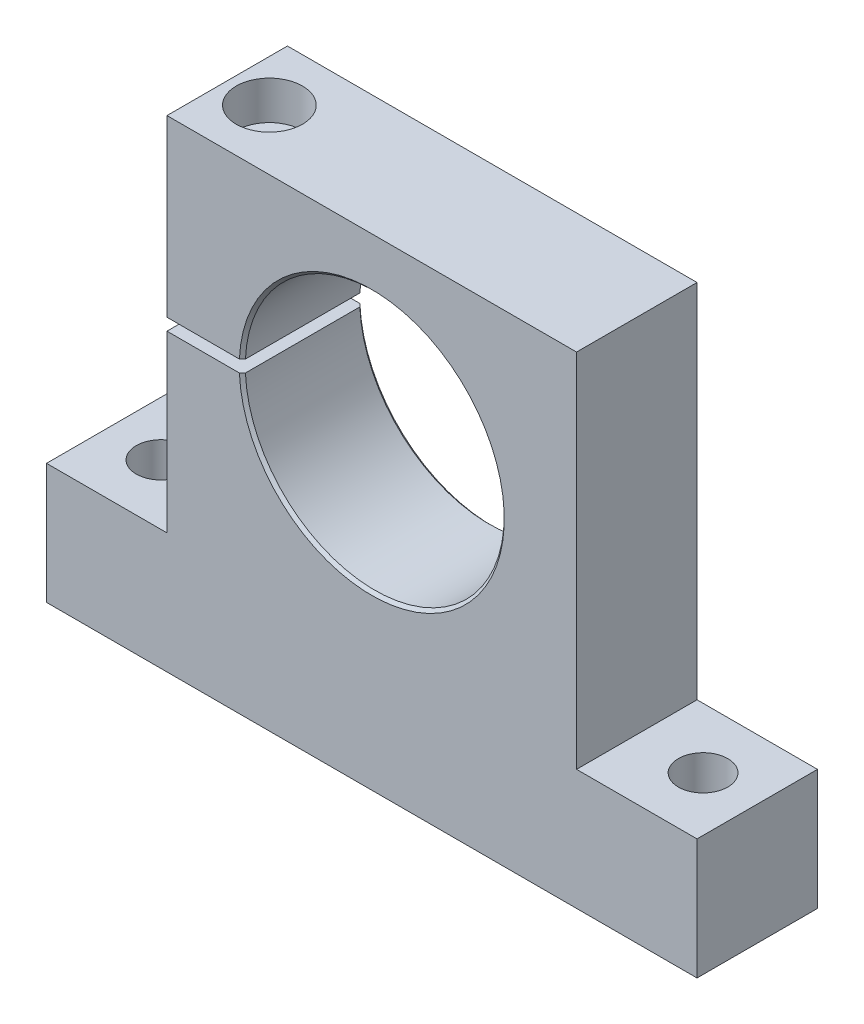
from build123d import *

# Parameters (mm, degrees)
SCHIZZO1_R                                          = 21.5
ESTRUSIONE_ESTRUSIONE1_DEPTH                        = 20
F_8_2_8_2_DIAMETER_HOLE1_D                          = 8.2
CBORE_FOR_M6_HEX_SOCKET_HEAD_CAP_SCREW1_D           = 6.6
CBORE_FOR_M6_HEX_SOCKET_HEAD_CAP_SCREW1_DEPTH       = 50
CBORE_FOR_M6_HEX_SOCKET_HEAD_CAP_SCREW1_CBORE_D     = 11
CBORE_FOR_M6_HEX_SOCKET_HEAD_CAP_SCREW1_CBORE_DEPTH = 6.4
CBORE_FOR_M6_HEX_SOCKET_HEAD_CAP_SCREW1_TIP         = 1.982840043
SCHIZZO7_W                                          = 15.52137419
SCHIZZO7_H                                          = 2
TAGLIO_ESTRUSIONE1_DEPTH                            = 136.882302012
CHAMFER1_SIZE                                       = 0.5
CHAMFER2_SIZE                                       = 0.5


with BuildPart() as part:
    # Schizzo1 → Estrusione-Estrusione1 (new body)
    with BuildSketch(Plane.XY):
        Polygon((0, 0), (108, 0), (108, 20), (88, 20), (88, 80), (20, 80), (20, 20), (0, 20), align=None)
        with Locations((54, 50)):
            Circle(SCHIZZO1_R, mode=Mode.SUBTRACT)
    extrude(amount=ESTRUSIONE_ESTRUSIONE1_DEPTH)

    # Ø8.2 (8.2) Diameter Hole1 (through all)
    with Locations(Plane(origin=(9, 20, 10), x_dir=(0, 0, 1), z_dir=(0, 1, 0))):
        with Locations((0, 0), (0, 90)):
            Hole(F_8_2_8_2_DIAMETER_HOLE1_D / 2)

    # CBORE for M6 Hex Socket Head Cap Screw1
    with Locations(Plane(origin=(27, 80, 10), x_dir=(0, 0, 1), z_dir=(0, 1, 0))):
        with Locations((0, 0)):
            CounterBoreHole(CBORE_FOR_M6_HEX_SOCKET_HEAD_CAP_SCREW1_D / 2, CBORE_FOR_M6_HEX_SOCKET_HEAD_CAP_SCREW1_CBORE_D / 2, CBORE_FOR_M6_HEX_SOCKET_HEAD_CAP_SCREW1_CBORE_DEPTH, depth=CBORE_FOR_M6_HEX_SOCKET_HEAD_CAP_SCREW1_DEPTH)
            with Locations((0, 0, -(CBORE_FOR_M6_HEX_SOCKET_HEAD_CAP_SCREW1_DEPTH + CBORE_FOR_M6_HEX_SOCKET_HEAD_CAP_SCREW1_TIP / 2))):  # 118° drill point
                Cone(0, CBORE_FOR_M6_HEX_SOCKET_HEAD_CAP_SCREW1_D / 2, CBORE_FOR_M6_HEX_SOCKET_HEAD_CAP_SCREW1_TIP, mode=Mode.SUBTRACT)

    # Schizzo7 → Taglio-Estrusione1 (cut, through all)
    with BuildSketch(Plane(origin=(0, 0, 0), x_dir=(-1, 0, 0), z_dir=(0, 0, -1))):
        with Locations((-27.66540179, 50)):
            Rectangle(SCHIZZO7_W, SCHIZZO7_H)
    extrude(amount=-TAGLIO_ESTRUSIONE1_DEPTH, mode=Mode.SUBTRACT)

    # Chamfer1
    chamfer1_edges = [part.edges().sort_by_distance(p)[0] for p in [
        (54.500135336, 71.494182112, 0),
    ]]
    chamfer(chamfer1_edges, length=CHAMFER1_SIZE)

    # Chamfer2
    chamfer2_edges = [part.edges().sort_by_distance(p)[0] for p in [
        (54.500135336, 28.505817888, 20),
    ]]
    chamfer(chamfer2_edges, length=CHAMFER2_SIZE)


solid = part.part
